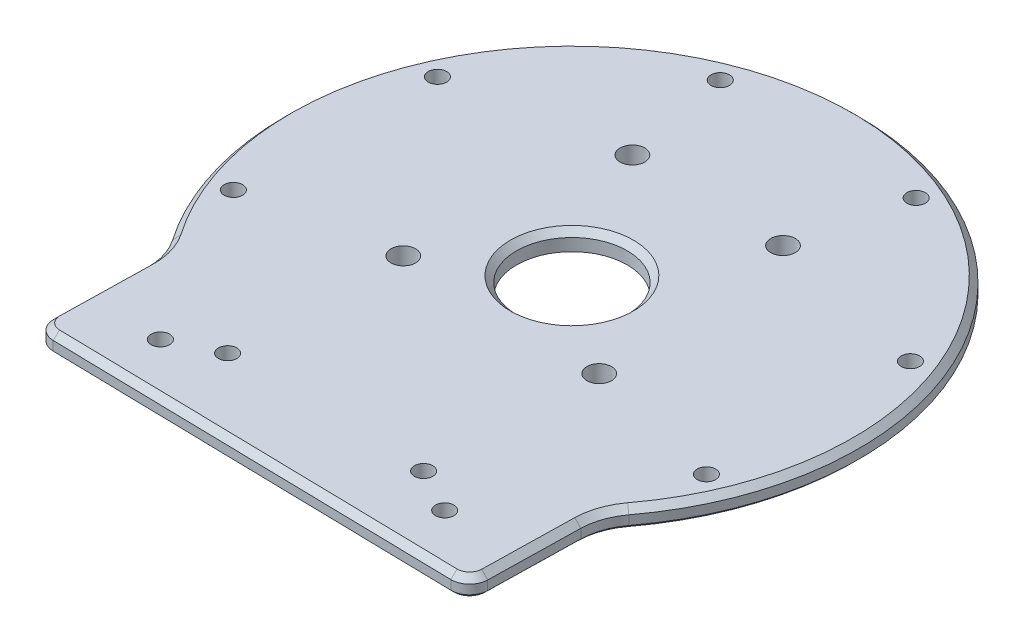
from build123d import *

# Parameters (mm, degrees)
SKETCH_1_R               = 1.5
SKETCH_1_R_2             = 9
EXTRUDE_1_DEPTH          = 3
CHAMFER_1_SIZE           = 0.5
CUT_EXTRUDE_1_DEPTH      = 302.180394913
CUT_EXTRUDE_1_DEPTH_BACK = 302.180394913
SKETCH_3_R               = 1.5
CUT_EXTRUDE_2_DEPTH      = 302.180394913
CUT_EXTRUDE_2_DEPTH_BACK = 302.180394913
SKETCH_4_R               = 2
CHAMFER_2_SIZE           = 1
CUT_EXTRUDE_3_DEPTH      = 302.180394913
CUT_EXTRUDE_3_DEPTH_BACK = 302.180394913
SKETCH_5_R               = 1.5


with BuildPart() as part:
    # 草图1 → 凸台-拉伸1 (new body)
    with BuildSketch(Plane.XZ.offset(-78.025173071)):
        with BuildLine():
            Line((-212.541244563, -109.249486882), (-212.240178336, -124.096924988))
            ThreePointArc((-212.240178336, -124.096924988), (-212.661273384, -127.177841531), (-214.008389255, -129.980455778))
            ThreePointArc((-214.008389255, -129.980455778), (-174.628775953, -203.200190572), (-138.249712047, -128.44427297))
            ThreePointArc((-138.249712047, -128.44427297), (-139.709332875, -125.698571817), (-140.25497588, -122.637258129))
            Line((-140.25497588, -122.637258129), (-140.556042107, -107.789820023))
            ThreePointArc((-140.556042107, -107.789820023), (-141.477547023, -105.686749262), (-143.616244995, -104.85125604))
            Line((-143.616244995, -104.85125604), (-209.60268058, -106.189283994))
            ThreePointArc((-209.60268058, -106.189283994), (-211.705751342, -107.11078891), (-212.541244563, -109.249486882))
        make_face()
        with Locations((-136.648445194, -139.453062321)):
            Circle(SKETCH_1_R, mode=Mode.SUBTRACT)
        with Locations((-175.575532096, -156.509788424)):
            Circle(SKETCH_1_R_2, mode=Mode.SUBTRACT)
        with Locations((-135.988998284, -171.974468852)):
            Circle(SKETCH_1_R, mode=Mode.SUBTRACT)
        with Locations((-191.040212525, -196.096322235)):
            Circle(SKETCH_1_R, mode=Mode.SUBTRACT)
        with Locations((-215.162065908, -141.045107995)):
            Circle(SKETCH_1_R, mode=Mode.SUBTRACT)
        with Locations((-192.632258198, -117.582701522)):
            Circle(SKETCH_1_R, mode=Mode.SUBTRACT)
        with Locations((-160.110851668, -116.923254612)):
            Circle(SKETCH_1_R, mode=Mode.SUBTRACT)
        with Locations((-214.502618998, -173.566514526)):
            Circle(SKETCH_1_R, mode=Mode.SUBTRACT)
        with Locations((-158.518805994, -195.436875326)):
            Circle(SKETCH_1_R, mode=Mode.SUBTRACT)
    extrude(amount=EXTRUDE_1_DEPTH)

    # 倒角1
    chamfer_1_edges = [part.edges().sort_by_distance(p)[0] for p in [
        (-211.705751339, 75.025173077, -107.110788911),
        (-212.390711447, 75.025173077, -116.673205936),
        (-212.661273381, 75.025173077, -127.177841532),
        (-174.628775951, 75.025173075, -203.200190573),
        (-139.709332873, 75.025173075, -125.698571818),
        (-140.405508991, 75.025173075, -115.213539077),
        (-141.477547021, 75.025173075, -105.686749262),
        (-176.609462785, 75.025173076, -105.520270018),
    ]]
    chamfer(chamfer_1_edges, length=CHAMFER_1_SIZE)

    # 草图3 → 切除-拉伸1 (cut, two sides: drawn at the far end of the back side and taken through both)
    with BuildSketch(Plane.XZ.offset(-75.025173071).offset(-CUT_EXTRUDE_1_DEPTH_BACK)):
        with Locations((-200.041202679, -114.05266186)):
            Circle(SKETCH_3_R)
    extrude(amount=CUT_EXTRUDE_1_DEPTH + CUT_EXTRUDE_1_DEPTH_BACK, mode=Mode.SUBTRACT)

    # 草图4 → 切除-拉伸2 (cut, two sides: drawn at the far end of the back side and taken through both)
    with BuildSketch(Plane(origin=(2e-09, 78.025173071, -1e-09), x_dir=(1.0, -3.1446611841336594e-11, 0), z_dir=(3.1446611841336594e-11, 1.0, -6.574611909583631e-12)).offset(-CUT_EXTRUDE_2_DEPTH_BACK)):
        with Locations(Location((-192.064609975, 145.576946921, 0), (0, 0, 180))):
            Circle(SKETCH_4_R)
        with Locations(Location((-159.543203445, 144.917500011, 0), (0, 0, 180))):
            Circle(SKETCH_4_R)
        with Locations(Location((-187.634036488, 178.409388234, 0), (0, 0, 180))):
            Circle(SKETCH_4_R)
        with Locations(Location((-162.639174524, 177.902559463, 0), (0, 0, 180))):
            Circle(SKETCH_4_R)
    extrude(amount=CUT_EXTRUDE_2_DEPTH + CUT_EXTRUDE_2_DEPTH_BACK, mode=Mode.SUBTRACT)

    # 倒角2
    chamfer_2_edges = [part.edges().sort_by_distance(p)[0] for p in [
        (-212.390711447, 78.025173077, -116.673205936),
        (-211.705751339, 78.025173077, -107.110788911),
        (-176.609462785, 78.025173076, -105.520270018),
        (-141.477547021, 78.025173075, -105.686749262),
        (-184.575532094, 78.025173076, -156.509788424),
        (-140.405508991, 78.025173075, -115.213539077),
        (-139.709332873, 78.025173075, -125.698571818),
        (-174.62877595, 78.025173075, -203.200190573),
        (-212.661273381, 78.025173077, -127.177841532),
    ]]
    chamfer(chamfer_2_edges, length=CHAMFER_2_SIZE)

    # 草图5 → 切除-拉伸3 (cut, two sides: drawn at the far end of the back side and taken through both)
    with BuildSketch(Plane.XZ.offset(-75.025173071).offset(-CUT_EXTRUDE_3_DEPTH_BACK)):
        with Locations((-152.851097985, -113.09577309)):
            Circle(SKETCH_5_R)
    extrude(amount=CUT_EXTRUDE_3_DEPTH + CUT_EXTRUDE_3_DEPTH_BACK, mode=Mode.SUBTRACT)


solid = part.part
